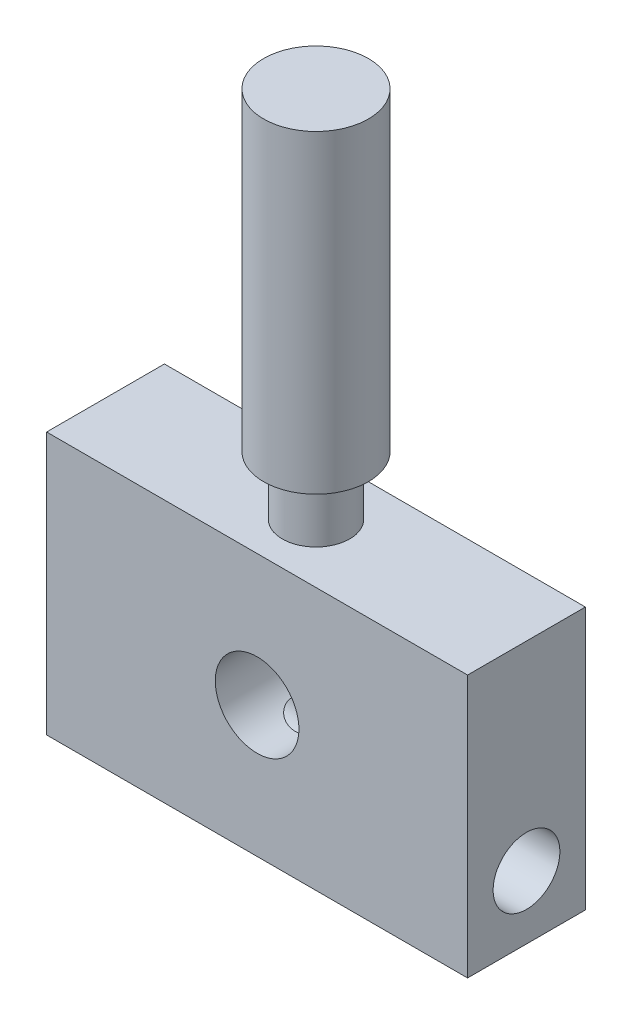
from build123d import *

# Parameters (mm, degrees)
SKETCH1_W           = 107.199818646
SKETCH1_H           = 66.816994634
BOSS_EXTRUDE1_DEPTH = 15
SKETCH2_R           = 8.587881919
BOSS_EXTRUDE2_DEPTH = 15
SKETCH3_R           = 13.34182577
BOSS_EXTRUDE3_DEPTH = 80
SKETCH4_R           = 8.5
CUT_EXTRUDE1_DEPTH  = 110
SKETCH5_R           = 10.65
CUT_EXTRUDE2_DEPTH  = 30


with BuildPart() as part:
    # Sketch1 → Boss-Extrude1 (new, symmetric)
    with BuildSketch(Plane.XY):
        Rectangle(SKETCH1_W, SKETCH1_H)
    extrude(amount=BOSS_EXTRUDE1_DEPTH, both=True)

    # Sketch2 → Boss-Extrude2 (add)
    with BuildSketch(Plane(origin=(0, 33.408497317, 0), x_dir=(1, 0, 0), z_dir=(0, 1, 0))):
        with Locations(Location((0, 0, 0), (0, 0, 90))):
            Circle(SKETCH2_R)
    extrude(amount=BOSS_EXTRUDE2_DEPTH)

    # Sketch3 → Boss-Extrude3 (add)
    with BuildSketch(Plane(origin=(0, 48.408497317, 0), x_dir=(1, 0, 0), z_dir=(0, 1, 0))):
        with Locations(Location((0, 0, 0), (0, 0, 270))):
            Circle(SKETCH3_R)
    extrude(amount=BOSS_EXTRUDE3_DEPTH)

    # Sketch4 → Cut-Extrude1 (cut)
    with BuildSketch(Plane.ZY.offset(53.599909323)):
        with Locations((0, -17.285411507)):
            Circle(SKETCH4_R)
    extrude(amount=-CUT_EXTRUDE1_DEPTH, mode=Mode.SUBTRACT)

    # Sketch5 → Cut-Extrude2 (cut)
    with BuildSketch(Plane(origin=(0, 0, -15), x_dir=(-1, 0, 0), z_dir=(0, 0, -1))):
        Circle(SKETCH5_R)
    extrude(amount=-CUT_EXTRUDE2_DEPTH, mode=Mode.SUBTRACT)


solid = part.part
